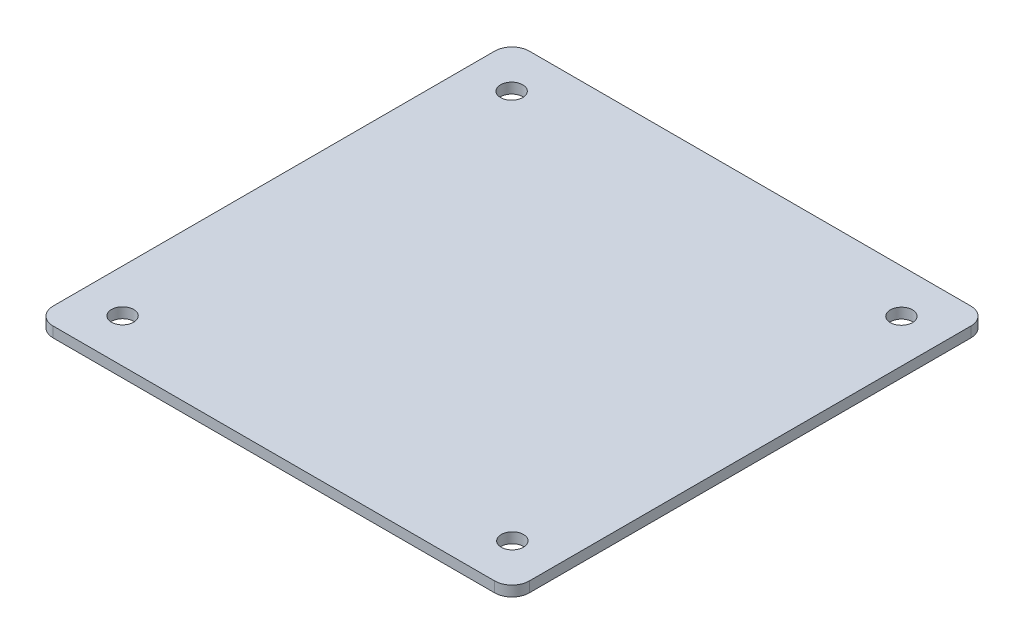
from build123d import *

# Parameters (mm, degrees)
SKETCH1_W           = 70
SKETCH1_H           = 70
SKETCH1_R           = 1.63195
BOSS_EXTRUDE1_DEPTH = 1.524
FILLET1_R           = 2.54


with BuildPart() as part:
    # Sketch1 → Boss-Extrude1 (new body)
    with BuildSketch(Plane(origin=(0, 0, 0), x_dir=(1, 0, 0), z_dir=(0, 1, 0))):
        with Locations((35.5, 20.5)):
            Rectangle(SKETCH1_W, SKETCH1_H)
        with Locations(Location((6.85, 49.098058775, 0), (0, 0, 90))):
            Circle(SKETCH1_R, mode=Mode.SUBTRACT)
        with Locations(Location((6.85, -8.098058775, 0), (0, 0, 90))):
            Circle(SKETCH1_R, mode=Mode.SUBTRACT)
        with Locations(Location((64.15, -8.098058775, 0), (0, 0, 90))):
            Circle(SKETCH1_R, mode=Mode.SUBTRACT)
        with Locations(Location((64.15, 49.098058775, 0), (0, 0, 90))):
            Circle(SKETCH1_R, mode=Mode.SUBTRACT)
    extrude(amount=BOSS_EXTRUDE1_DEPTH)

    # Fillet1
    fillet1_edges = [part.edges().sort_by_distance(p)[0] for p in [
        (0.5, 0.762, -55.5),
        (70.5, 0.762, -55.5),
        (70.5, 0.762, 14.5),
        (0.5, 0.762, 14.5),
    ]]
    fillet(fillet1_edges, radius=FILLET1_R)


solid = part.part
